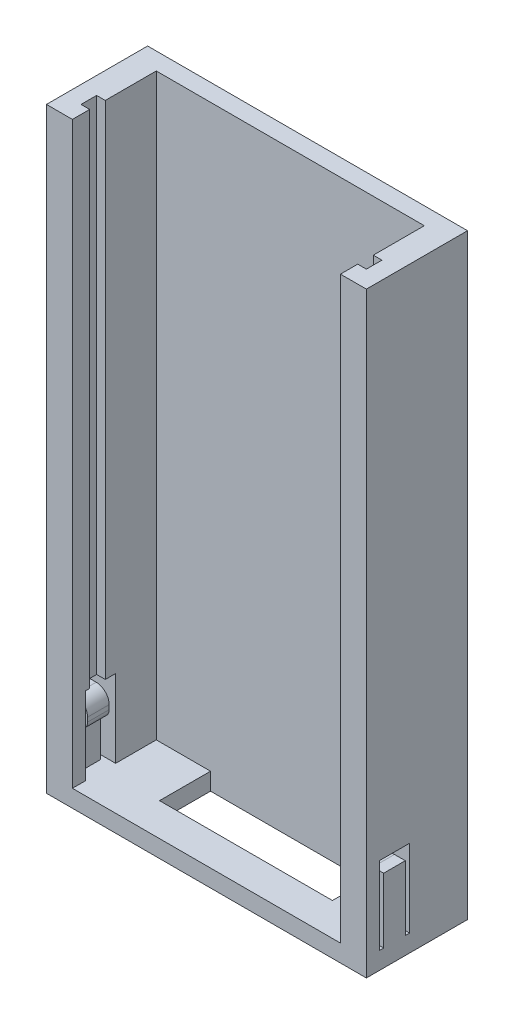
from build123d import *

# Parameters (mm, degrees)
SKETCH1_W           = 37
SKETCH1_H           = 11.7
BOSS_EXTRUDE1_DEPTH = 69
CUT_EXTRUDE1_DEPTH  = 67
SKETCH3_W           = 20
SKETCH3_H           = 5.9
CUT_EXTRUDE2_DEPTH  = 67
SKETCH4_R           = 1.9
BOSS_EXTRUDE2_DEPTH = 3
FILLET1_R           = 2
SKETCH5_W           = 3.5
SKETCH5_H           = 9
CUT_EXTRUDE3_DEPTH  = 40
BOSS_EXTRUDE3_START = 0.5
BOSS_EXTRUDE3_DEPTH = 2.5


with BuildPart() as part:
    # Sketch1 → Boss-Extrude1 (new body)
    with BuildSketch(Plane(origin=(0, 0, 0), x_dir=(1, 0, 0), z_dir=(0, 1, 0))):
        with Locations((18.5, 5.85)):
            Rectangle(SKETCH1_W, SKETCH1_H)
    extrude(amount=BOSS_EXTRUDE1_DEPTH)

    # Sketch2 → Cut-Extrude1 (cut)
    with BuildSketch(Plane(origin=(0, 69, 0), x_dir=(1, 0, 0), z_dir=(0, 1, 0))):
        Polygon((3, 0), (3, 2), (2, 2), (2, 3.8), (3, 3.8), (3, 9.7), (34, 9.7), (34, 3.8), (35, 3.8), (35, 2), (34, 2), (34, 0), align=None)
    extrude(amount=-CUT_EXTRUDE1_DEPTH, mode=Mode.SUBTRACT)

    # Sketch3 → Cut-Extrude2 (cut)
    with BuildSketch(Plane(origin=(0, 2, 0), x_dir=(1, 0, 0), z_dir=(0, 1, 0))):
        with Locations((19.275, 6.75)):
            Rectangle(SKETCH3_W, SKETCH3_H)
    extrude(amount=-CUT_EXTRUDE2_DEPTH, mode=Mode.SUBTRACT)

    # Sketch4 → Boss-Extrude2 (add)
    # profile 1 of 2: a face of its own
    with BuildSketch(Plane(origin=(48.7, 0, -11.7), x_dir=(-1, 0, 0), z_dir=(0, 0, -1))):
        with BuildLine():
            Line((48.7, 55.9), (52.5, 55.9))
            ThreePointArc((52.5, 55.9), (56.4, 52), (52.5, 48.1))
            Line((52.5, 48.1), (48.7, 48.1))
            Line((48.7, 48.1), (48.7, 55.9))
        make_face()
        with Locations((52.5, 52)):
            Circle(SKETCH4_R, mode=Mode.SUBTRACT)
    # profile 2 of 2: a face of its own
    with BuildSketch(Plane(origin=(48.7, 0, -11.7), x_dir=(-1, 0, 0), z_dir=(0, 0, -1))):
        with BuildLine():
            Line((48.7, 19.9), (52.5, 19.9))
            ThreePointArc((52.5, 19.9), (56.4, 16), (52.5, 12.1))
            Line((52.5, 12.1), (48.7, 12.1))
            Line((48.7, 12.1), (48.7, 19.9))
        make_face()
        with Locations((52.5, 16)):
            Circle(SKETCH4_R, mode=Mode.SUBTRACT)
    extrude(amount=-BOSS_EXTRUDE2_DEPTH)

    # Fillet1
    fillet1_edges = [part.edges().sort_by_distance(p)[0] for p in [
        (0, 48.1, -10.2),
        (0, 55.9, -10.2),
        (0, 12.1, -10.2),
        (0, 19.9, -10.2),
    ]]
    fillet(fillet1_edges, radius=FILLET1_R)

    # Sketch5 → Cut-Extrude3 (cut)
    with BuildSketch(Plane(origin=(37, 0, 0), x_dir=(0, 0, -1), z_dir=(1, 0, 0))):
        with Locations((3.25, 6.5)):
            Rectangle(SKETCH5_W, SKETCH5_H)
    extrude(amount=-CUT_EXTRUDE3_DEPTH, mode=Mode.SUBTRACT)

    # Sketch6 → Boss-Extrude3 (add)
    with BuildSketch(Plane(origin=(0, 0, -1.5), x_dir=(-1, 0, 0), z_dir=(0, 0, -1)).offset(BOSS_EXTRUDE3_START)):
        with BuildLine():
            Line((0, 2), (0, 9.5))
            Line((0, 9.5), (-1.25, 9.5))
            ThreePointArc((-1.25, 9.5), (-2.310660172, 9.060660172), (-2.75, 8))
            Line((-2.75, 8), (-2.75, 7.5))
            ThreePointArc((-2.75, 7.5), (-2.457106781, 6.792893219), (-1.75, 6.5))
            Line((-1.75, 6.5), (-1.75, 2))
            Line((-1.75, 2), (0, 2))
        make_face()
    boss_extrude3 = extrude(amount=BOSS_EXTRUDE3_DEPTH)

    # Mirror1: Boss-Extrude3 across plane
    add(boss_extrude3.mirror(Plane.ZY.offset(-18.5)))


solid = part.part
